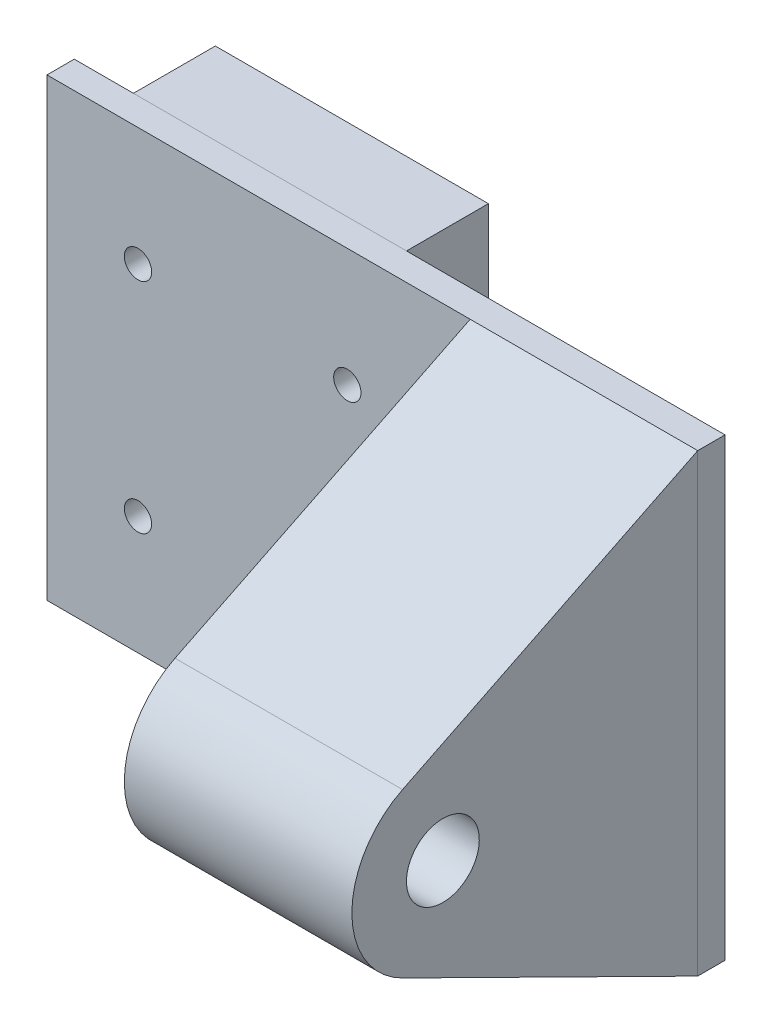
from build123d import *

# Parameters (mm, degrees)
ESQUISSE1_W             = 30
ESQUISSE1_H             = 50
BOSS_EXTRU_1_DEPTH      = 9
ESQUISSE2_W             = 71.5
ESQUISSE2_H             = 50
BOSS_EXTRU_2_DEPTH      = 3
ESQUISSE3_R             = 4
BOSS_EXTRU_3_DEPTH      = 25
ESQUISSE4_R             = 1.5
ENL_V_MAT_EXTRU_1_DEPTH = 91.382520434


with BuildPart() as part:
    # Esquisse1 → Boss.-Extru.1 (new body)
    with BuildSketch(Plane.XY):
        with Locations((15, 25)):
            Rectangle(ESQUISSE1_W, ESQUISSE1_H)
    extrude(amount=BOSS_EXTRU_1_DEPTH)


with BuildPart() as body_2:
    # Esquisse2 → Boss.-Extru.2 (new body)
    with BuildSketch(Plane.XY.offset(9)):
        with Locations((29.25, 25)):
            Rectangle(ESQUISSE2_W, ESQUISSE2_H)
    extrude(amount=BOSS_EXTRU_2_DEPTH)

    # Esquisse4 → Enlèv. mat.-Extru.1 (cut, through all)
    with BuildSketch(Plane.XY.offset(12)):
        with Locations((26.5, 37)):
            Circle(ESQUISSE4_R)
        with Locations((26.5, 13)):
            Circle(ESQUISSE4_R)
        with Locations((3.5, 13)):
            Circle(ESQUISSE4_R)
        with Locations((3.5, 37)):
            Circle(ESQUISSE4_R)
    extrude(amount=-ENL_V_MAT_EXTRU_1_DEPTH, mode=Mode.SUBTRACT)


with BuildPart() as body_3:
    # Esquisse3 → Boss.-Extru.3 (new body)
    with BuildSketch(Plane(origin=(65, 0, 0), x_dir=(0, 0, -1), z_dir=(1, 0, 0))):
        with BuildLine():
            Line((-12, 50), (-12, 0))
            Line((-12, 0), (-44.432240069, 16.035891122))
            ThreePointArc((-44.432240069, 16.035891122), (-50, 25), (-44.432240069, 33.964108878))
            Line((-44.432240069, 33.964108878), (-12, 50))
        make_face()
        with Locations(Location((-40, 25, 0), (0, 0, 90))):
            Circle(ESQUISSE3_R, mode=Mode.SUBTRACT)
    extrude(amount=-BOSS_EXTRU_3_DEPTH)


solid = Compound([part.part, body_2.part, body_3.part])
